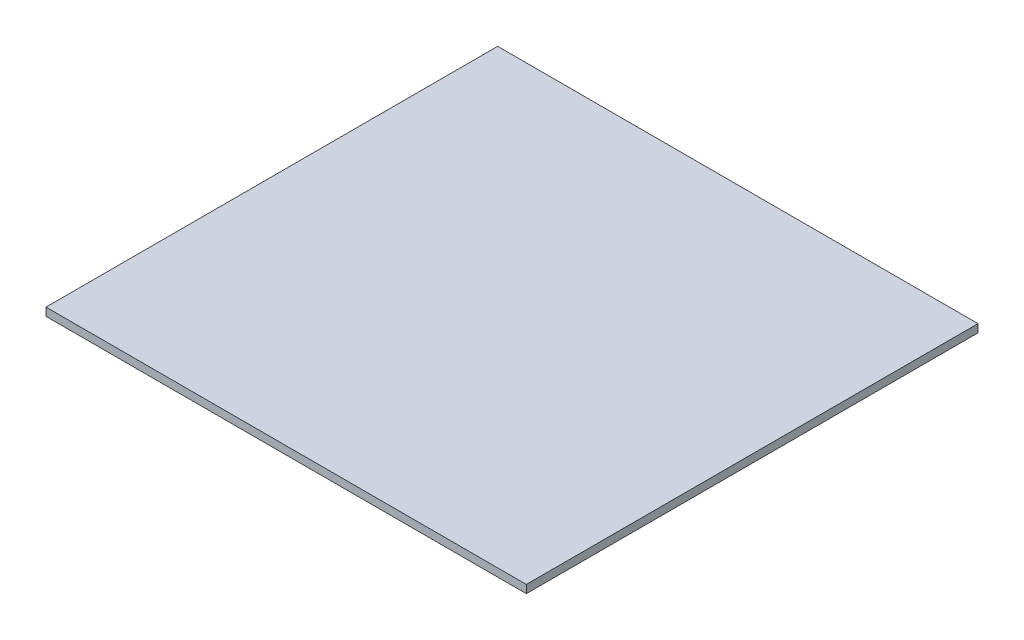
from build123d import *

# Parameters (mm, degrees)
SKETCH1_W           = 95.89
SKETCH1_H           = 90.17
BOSS_EXTRUDE1_DEPTH = 1.6


with BuildPart() as part:
    # Sketch1 → Boss-Extrude1 (new body)
    with BuildSketch(Plane(origin=(0, 0, 0), x_dir=(1, 0, 0), z_dir=(0, 1, 0))):
        Rectangle(SKETCH1_W, SKETCH1_H)
    extrude(amount=BOSS_EXTRUDE1_DEPTH)


solid = part.part
